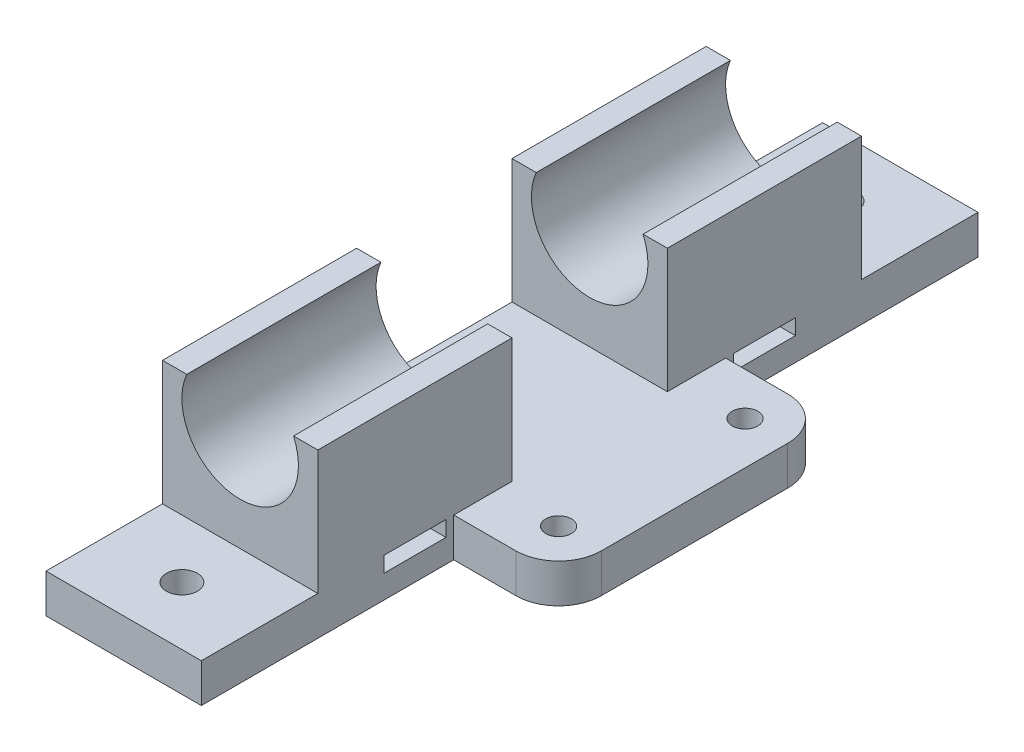
from build123d import *

# Parameters (mm, degrees)
ESBO_O1_W                = 8
ESBO_O1_H                = 2
RESSALTO_EXTRUS_O1_DEPTH = 10
CORTE_EXTRUS_O1_REACH    = 75.763
ESBO_O4_W                = 20
ESBO_O4_H                = 15
ESBO_O4_R                = 2
RESSALTO_EXTRUS_O2_DEPTH = 5
ESBO_O5_R                = 1.65
RESSALTO_EXTRUS_O3_DEPTH = 5


with BuildPart() as part:
    # Esboço1 → Ressalto-extrusão1 (new, symmetric)
    with BuildSketch(Plane(origin=(0, 0, 0), x_dir=(0, 0, -1), z_dir=(1, 0, 0))):
        Polygon((-35, 21), (-10, 21), (-10, 5), (10, 5), (10, 21), (35, 21), (35, 0), (-35, 0), align=None)
        with Locations((-22.5, 4)):
            Rectangle(ESBO_O1_W, ESBO_O1_H, mode=Mode.SUBTRACT)
        with Locations((22.5, 4)):
            Rectangle(ESBO_O1_W, ESBO_O1_H, mode=Mode.SUBTRACT)
    extrude(amount=RESSALTO_EXTRUS_O1_DEPTH, both=True)

    # Corte-extrusão1: up to this face of the body (flat: up to its plane)
    corte_extrus_o1_end = Plane(part.part.faces().sort_by_distance((0, 10.5, -35))[0])
    # Esboço2 → Corte-extrusão1 (cut, up to the picked face)
    with BuildSketch(Plane.XY.offset(35), mode=Mode.PRIVATE) as corte_extrus_o1_sk1:
        with BuildLine():
            Line((-6.873863542, 21), (6.873863542, 21))
            ThreePointArc((6.873863542, 21), (0, 10.5), (-6.873863542, 21))
        make_face()
    corte_extrus_o1_tool1 = split(extrude(corte_extrus_o1_sk1.sketch, amount=-CORTE_EXTRUS_O1_REACH, mode=Mode.PRIVATE), bisect_by=corte_extrus_o1_end, keep=Keep.BOTH, mode=Mode.PRIVATE)
    add(corte_extrus_o1_tool1.solids().sort_by(Axis((0, 16.361219, 35), (0, 0, -1)))[0], mode=Mode.SUBTRACT)

    # Esboço4 → Ressalto-extrusão2 (add)
    # profile 1 of 2: a face of its own
    with BuildSketch(Plane(origin=(0, 5, 0), x_dir=(1, 0, 0), z_dir=(0, 1, 0))):
        with Locations((0, 42.5)):
            Rectangle(ESBO_O4_W, ESBO_O4_H)
        with Locations(Location((0, 42.5, 0), (0, 0, 270))):
            Circle(ESBO_O4_R, mode=Mode.SUBTRACT)
    # profile 2 of 2: a face of its own
    with BuildSketch(Plane(origin=(0, 5, 0), x_dir=(1, 0, 0), z_dir=(0, 1, 0))):
        with Locations((0, -42.5)):
            Rectangle(ESBO_O4_W, ESBO_O4_H)
        with Locations(Location((0, -42.5, 0), (0, 0, 270))):
            Circle(ESBO_O4_R, mode=Mode.SUBTRACT)
    extrude(amount=-RESSALTO_EXTRUS_O2_DEPTH)

    # Esboço5 → Ressalto-extrusão3 (add)
    with BuildSketch(Plane.XZ):
        with BuildLine():
            Line((18, 17.5), (10, 17.5))
            Line((10, 17.5), (10, -17.5))
            Line((10, -17.5), (18, -17.5))
            ThreePointArc((18, -17.5), (21.889087297, -15.889087297), (23.5, -12))
            Line((23.5, -12), (23.5, 12))
            ThreePointArc((23.5, 12), (21.889087297, 15.889087297), (18, 17.5))
        make_face()
        with Locations(Location((18, 12, 0), (0, 0, 270))):
            Circle(ESBO_O5_R, mode=Mode.SUBTRACT)
        with Locations(Location((18, -12, 0), (0, 0, 270))):
            Circle(ESBO_O5_R, mode=Mode.SUBTRACT)
    extrude(amount=-RESSALTO_EXTRUS_O3_DEPTH)


solid = part.part
